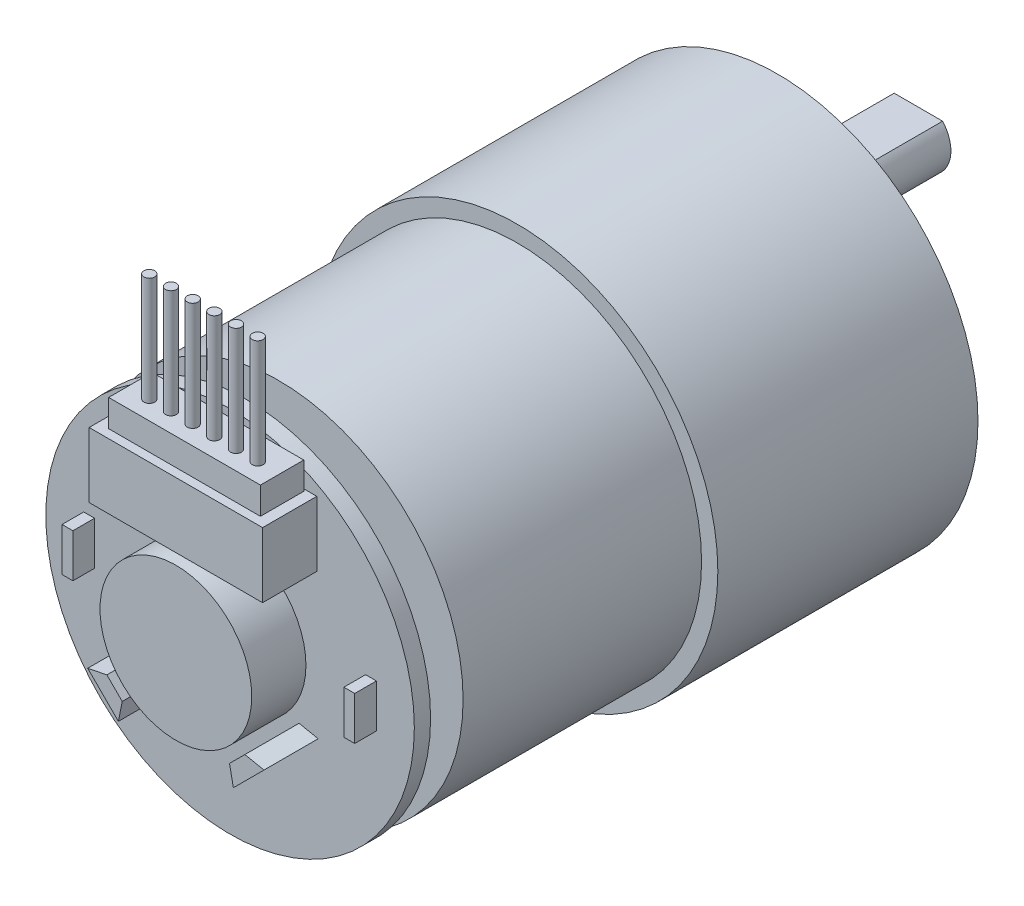
from build123d import *

# Parameters (mm, degrees)
SKETCH_1_R             = 18.5
EXTRUDE_1_DEPTH        = 24
SKETCH_2_R             = 17
EXTRUDE_2_DEPTH        = 22
SKETCH_3_R             = 3
SKETCH_3_W             = 0.5
SKETCH_3_H             = 3
EXTRUDE_3_DEPTH        = 3
SKETCH_4_R             = 17
EXTRUDE_4_DEPTH        = 1.5
SKETCH_5_R             = 7
EXTRUDE_5_DEPTH        = 5
SKETCH_6_W             = 1
SKETCH_6_H             = 4
EXTRUDE_6_DEPTH        = 2
SKETCH_7_W             = 16
SKETCH_7_H             = 6
EXTRUDE_7_DEPTH        = 5
SKETCH_8_W             = 14
SKETCH_8_H             = 4
EXTRUDE_8_DEPTH        = 2.5
SKETCH_9_R             = 0.5
EXTRUDE_9_DEPTH        = 10
PATTERN_LINEAR_1_COUNT = 6
PATTERN_LINEAR_1_PITCH = 2
SKETCH_11_R            = 5.5
EXTRUDE_10_DEPTH       = 5.5
EXTRUDE_11_DEPTH       = 15
CUT_EXTRUDE_2_DEPTH    = 0.4
SKETCH_14_R            = 2
CUT_EXTRUDE_3_DEPTH    = 0.5
SKETCH_15_R            = 2
CUT_EXTRUDE_4_DEPTH    = 3


with BuildPart() as part:
    # 草图1 → 凸台-拉伸1 (new body)
    with BuildSketch(Plane.XY):
        Circle(SKETCH_1_R)
    extrude(amount=EXTRUDE_1_DEPTH)

    # 草图2 → 凸台-拉伸2 (add)
    with BuildSketch(Plane.XY.offset(24)):
        Circle(SKETCH_2_R)
    extrude(amount=EXTRUDE_2_DEPTH)

    # 草图3 → 凸台-拉伸3 (add)
    with BuildSketch(Plane.XY.offset(46)):
        Circle(SKETCH_3_R)
        with Locations((-12.75, 0)):
            Rectangle(SKETCH_3_W, SKETCH_3_H)
        with Locations((12.75, 0)):
            Rectangle(SKETCH_3_W, SKETCH_3_H)
    extrude(amount=EXTRUDE_3_DEPTH)

    # 草图4 → 凸台-拉伸4 (add)
    with BuildSketch(Plane.XY.offset(49)):
        Circle(SKETCH_4_R)
    extrude(amount=EXTRUDE_4_DEPTH)

    # 草图5 → 凸台-拉伸5 (add)
    with BuildSketch(Plane.XY.offset(50.5)):
        Circle(SKETCH_5_R)
        Polygon((-5.656854249, -5.656854249), (-6.363961031, -4.949747468), (-8.131727984, -5.303300859), (-6.717514421, -6.717514421), (-5.303300859, -8.131727984), (-4.949747468, -6.363961031), align=None)
        Polygon((5.656854249, -5.656854249), (6.363961031, -4.949747468), (8.131727984, -5.303300859), (6.717514421, -6.717514421), (5.303300859, -8.131727984), (4.949747468, -6.363961031), align=None)
    extrude(amount=EXTRUDE_5_DEPTH)

    # 草图6 → 凸台-拉伸6 (add)
    with BuildSketch(Plane.XY.offset(50.5)):
        with Locations((-13, 0)):
            Rectangle(SKETCH_6_W, SKETCH_6_H)
        with Locations((13, 0)):
            Rectangle(SKETCH_6_W, SKETCH_6_H)
    extrude(amount=EXTRUDE_6_DEPTH)

    # 草图7 → 凸台-拉伸7 (add)
    with BuildSketch(Plane.XY.offset(50.5)):
        with Locations((0, 11)):
            Rectangle(SKETCH_7_W, SKETCH_7_H)
    extrude(amount=EXTRUDE_7_DEPTH)

    # 草图8 → 凸台-拉伸8 (add)
    with BuildSketch(Plane(origin=(0, 14, 0), x_dir=(1, 0, 0), z_dir=(0, 1, 0))):
        with Locations((0, -52.7)):
            Rectangle(SKETCH_8_W, SKETCH_8_H)
    extrude(amount=EXTRUDE_8_DEPTH)

    # 草图9 → 凸台-拉伸9 (add)
    with BuildSketch(Plane(origin=(0, 16.5, 0), x_dir=(1, 0, 0), z_dir=(0, 1, 0))):
        with Locations(Location((5, -52.95, 0), (0, 0, 270))):
            Circle(SKETCH_9_R)
    extrude_9 = extrude(amount=EXTRUDE_9_DEPTH)

    # 阵列(线性)1: 凸台-拉伸9 ×6
    with Locations(*[(-i * PATTERN_LINEAR_1_PITCH, 0, 0) for i in range(1, PATTERN_LINEAR_1_COUNT)]):
        add(extrude_9)

    # 草图11 → 凸台-拉伸10 (add)
    with BuildSketch(Plane(origin=(0, 0, 0), x_dir=(-1, 0, 0), z_dir=(0, 0, -1))):
        with Locations((7.498333348, -0.158104393)):
            Circle(SKETCH_11_R)
    extrude(amount=EXTRUDE_10_DEPTH)

    # 草图12 → 凸台-拉伸11 (add)
    with BuildSketch(Plane(origin=(0, 0, -5.5), x_dir=(-1, 0, 0), z_dir=(0, 0, -1))):
        with BuildLine():
            Line((5.262265371, 1.841895607), (9.734401326, 1.841895607))
            ThreePointArc((9.734401326, 1.841895607), (7.498333348, -3.158104393), (5.262265371, 1.841895607))
        make_face()
    extrude(amount=EXTRUDE_11_DEPTH)

    # 草图10 → 切除-拉伸2 (cut)
    with BuildSketch(Plane(origin=(0, 0, 0), x_dir=(-1, 0, 0), z_dir=(0, 0, -1))):
        with BuildLine():
            ThreePointArc((10.036531252, 6.36551051), (-11.882294081, 0.250541395), (9.759293221, -6.78291084))
            ThreePointArc((9.759293221, -6.78291084), (0.49988889, -0.010540293), (10.036531252, 6.36551051))
        make_face()
    extrude(amount=-CUT_EXTRUDE_2_DEPTH, mode=Mode.SUBTRACT)

    # 草图14 → 切除-拉伸3 (cut)
    with BuildSketch(Plane(origin=(0, 0, 0), x_dir=(-1, 0, 0), z_dir=(0, 0, -1))):
        with Locations((8.039373582, 13.833599402)):
            Circle(SKETCH_14_R)
        with Locations((7.449117181, -14.160178432)):
            Circle(SKETCH_14_R)
        with Locations((-15.996444476, 0.337289372)):
            Circle(SKETCH_14_R)
    extrude(amount=-CUT_EXTRUDE_3_DEPTH, mode=Mode.SUBTRACT)

    # 草图15 → 切除-拉伸4 (cut)
    with BuildSketch(Plane(origin=(0, 0, 0), x_dir=(-1, 0, 0), z_dir=(0, 0, -1))):
        with Locations((-0.337289372, -15.996444476)):
            Circle(SKETCH_15_R)
        with Locations((0.337289372, 15.996444476)):
            Circle(SKETCH_15_R)
        with Locations((-14.021971973, -7.706121074)):
            Circle(SKETCH_15_R)
        with Locations((-13.684682601, 8.290323403)):
            Circle(SKETCH_15_R)
        with Locations((13.684682601, -8.290323403)):
            Circle(SKETCH_15_R)
        with Locations((14.021971973, 7.706121074)):
            Circle(SKETCH_15_R)
    extrude(amount=-CUT_EXTRUDE_4_DEPTH, mode=Mode.SUBTRACT)


solid = part.part
